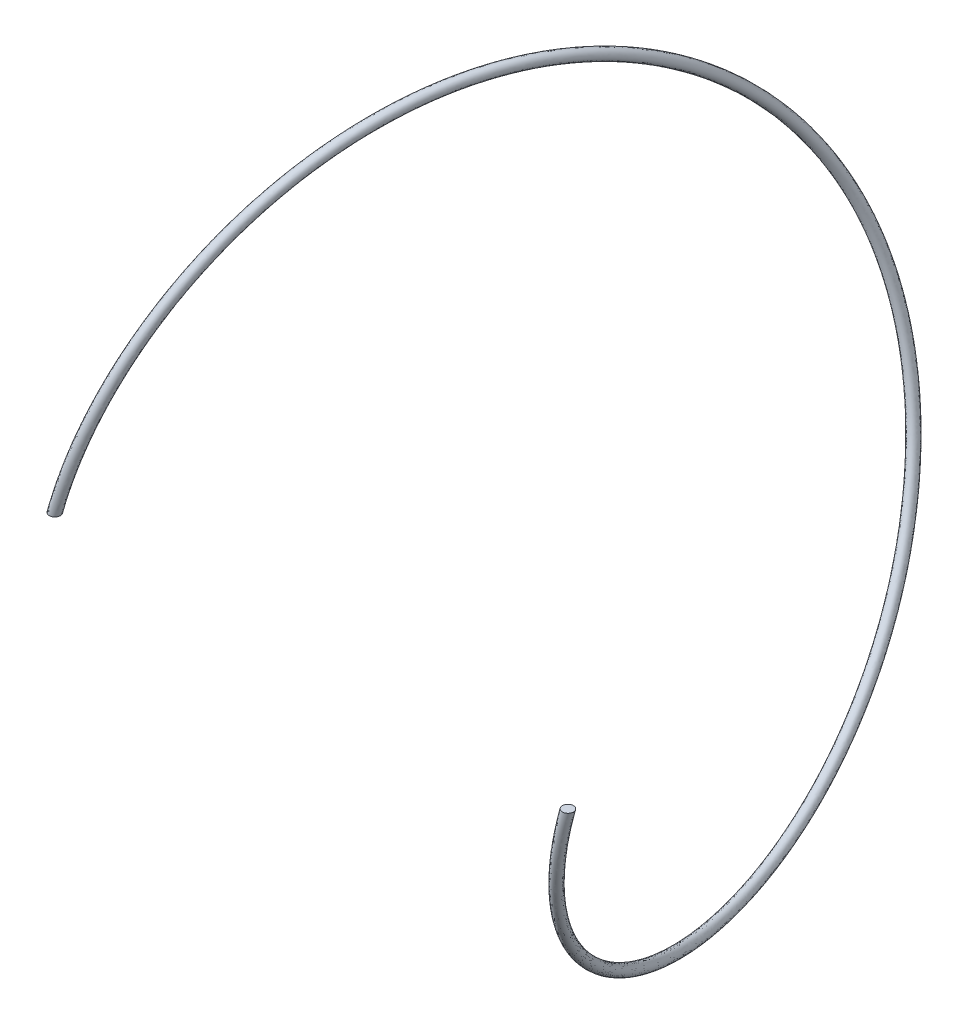
from build123d import *

# Parameters (mm, degrees)
SWEEP_1_PITCH  = 69.5
SWEEP_1_HEIGHT = 69.5
SWEEP_1_RADIUS = 40
SKETCH_2_R     = 0.75


with BuildPart() as part:
    # По траектории1: sweep along a helix
    with BuildLine() as sweep_1_path:
        Helix(SWEEP_1_PITCH, SWEEP_1_HEIGHT, SWEEP_1_RADIUS, center=(0, 0, 0), direction=(1, 0, 0), lefthand=True)
    # Эскиз2 → По траектории1 (sweep)
    with BuildSketch(Plane(origin=(0, 0, 0), x_dir=(1, 0, 0), z_dir=(0, 1, 0))):
        with Locations((0, -40)):
            Circle(SKETCH_2_R)
    sweep(path=sweep_1_path.line, is_frenet=True)


solid = part.part
